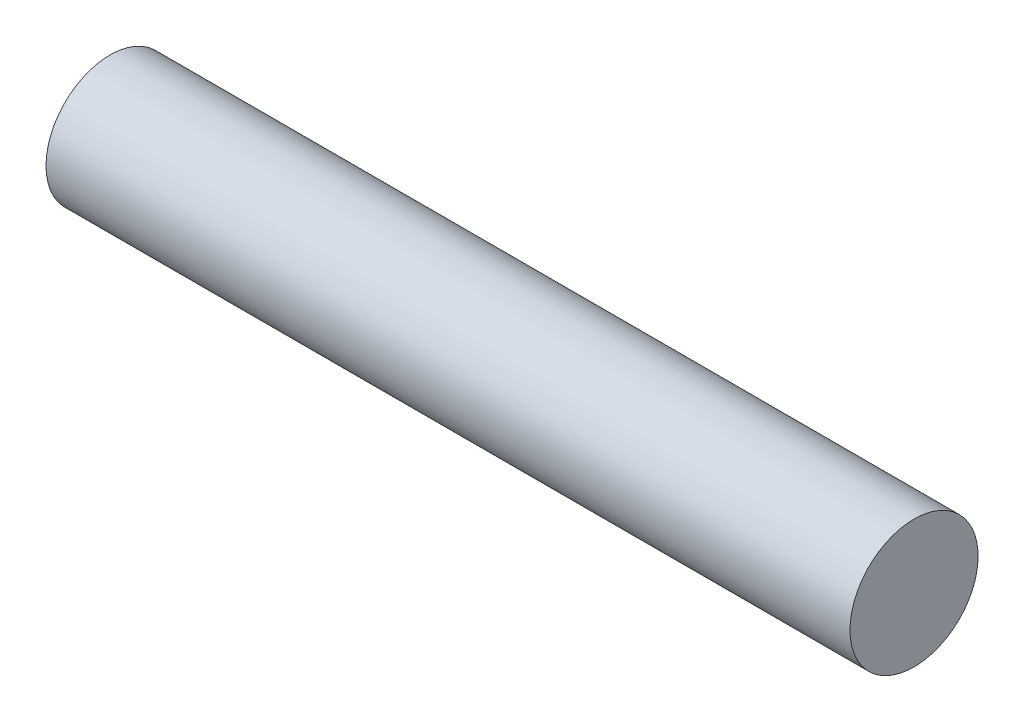
from build123d import *

# Parameters (mm, degrees)
SKETCH2_W = 800
SKETCH2_H = 63.75


with BuildPart() as part:
    # Sketch2 → Revolve1 (revolve)
    with BuildSketch(Plane(origin=(0, 0, 0), x_dir=(1, 0, 0), z_dir=(0, 1, 0))):
        with Locations((400, 31.875)):
            Rectangle(SKETCH2_W, SKETCH2_H)
    revolve(axis=Axis((800, 0, -63.75), (-1, 0, 0)))


solid = part.part
